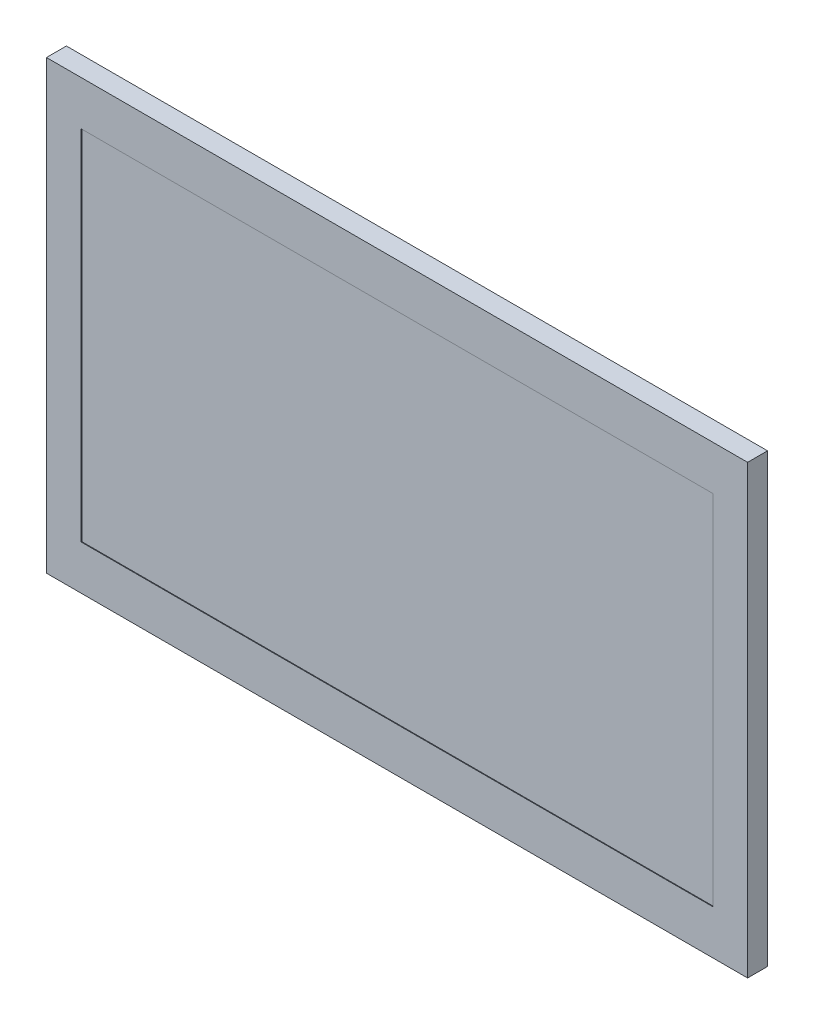
from build123d import *

# Parameters (mm, degrees)
SKETCH_1_W          = 105.5
SKETCH_1_H          = 67.2
EXTRUDE_1_DEPTH     = 3
SKETCH_2_W          = 95.04
SKETCH_2_H          = 53.85
CUT_EXTRUDE_1_DEPTH = 0.1


with BuildPart() as part:
    # 草图1 → 凸台-拉伸1 (new body)
    with BuildSketch(Plane.XY):
        Rectangle(SKETCH_1_W, SKETCH_1_H)
    extrude(amount=EXTRUDE_1_DEPTH)

    # 草图2 → 切除-拉伸1 (cut)
    with BuildSketch(Plane.XY.offset(3)):
        Rectangle(SKETCH_2_W, SKETCH_2_H)
    extrude(amount=-CUT_EXTRUDE_1_DEPTH, mode=Mode.SUBTRACT)


solid = part.part
